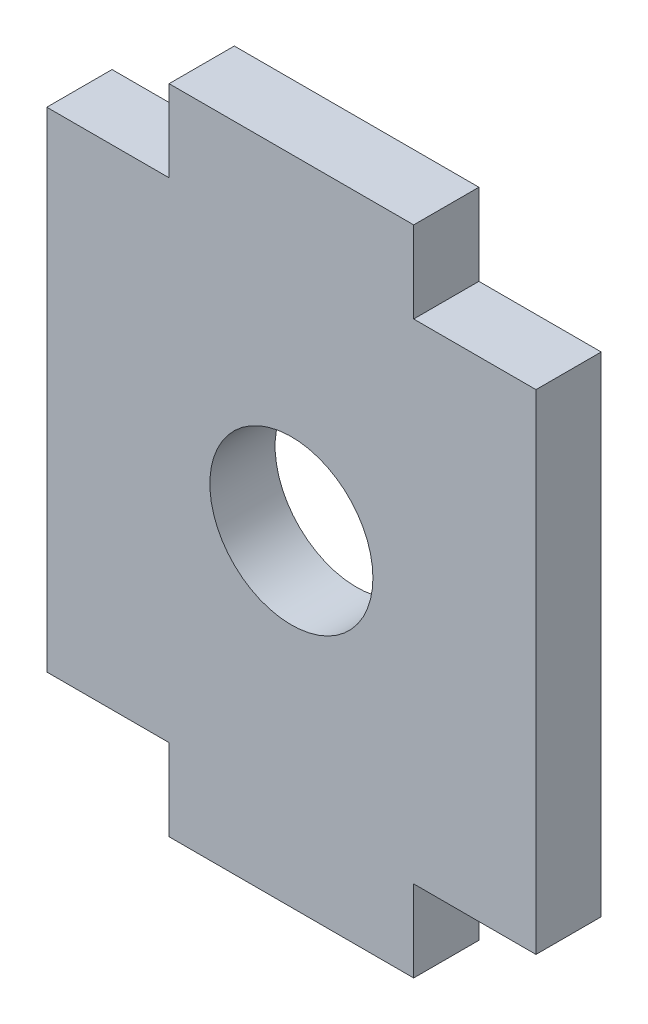
from build123d import *

# Parameters (mm, degrees)
BOSS_EXTRUDE1_DEPTH = 4
SKETCH2_R           = 5
CUT_EXTRUDE1_DEPTH  = 4


with BuildPart() as part:
    # Sketch1 → Boss-Extrude1 (new body)
    with BuildSketch(Plane.XY):
        Polygon((-7.5, 15), (-15, 15), (-15, -15), (-7.5, -15), (-7.5, -20), (7.5, -20), (7.5, -15), (15, -15), (15, 15), (7.5, 15), (7.5, 20), (-7.5, 20), align=None)
    extrude(amount=BOSS_EXTRUDE1_DEPTH)

    # Sketch2 → Cut-Extrude1 (cut)
    with BuildSketch(Plane.XY.offset(4)):
        Circle(SKETCH2_R)
    extrude(amount=-CUT_EXTRUDE1_DEPTH, mode=Mode.SUBTRACT)


solid = part.part
